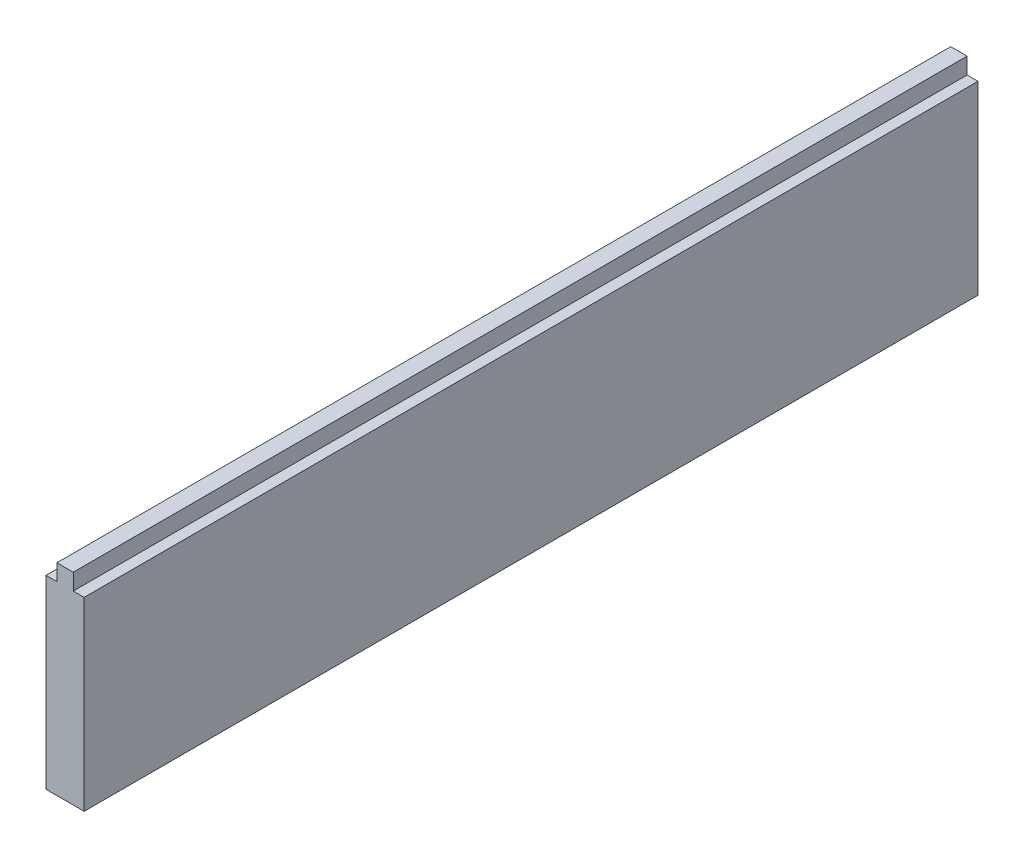
from build123d import *

# Parameters (mm, degrees)
EXTRUDE_1_DEPTH = 820


with BuildPart() as part:
    # Эскиз1 → Бобышка-Вытянуть1 (new body)
    with BuildSketch(Plane.XY):
        Polygon((0, 0), (0, 170), (10, 170), (10, 185), (25, 185), (25, 170), (35, 170), (35, 0), align=None)
    extrude(amount=-EXTRUDE_1_DEPTH)


solid = part.part
